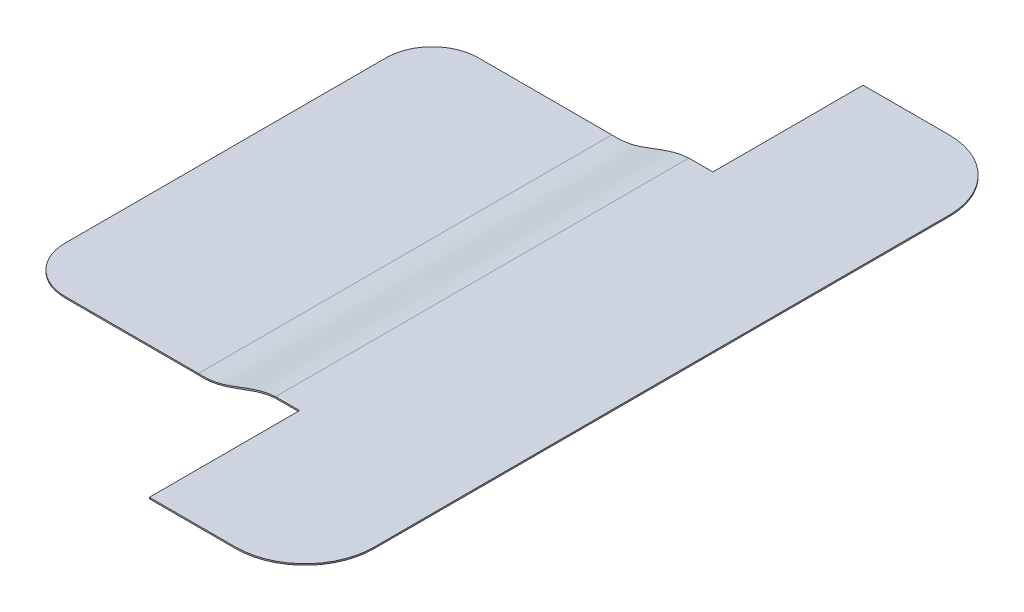
from build123d import *

# Parameters (mm, degrees)
BOSS_EXTRUDE1_DEPTH = 15.5
FILLET1_R           = 1.5
SKETCH3_W           = 6.938477294
SKETCH3_H           = 4.706519562
CUT_EXTRUDE2_DEPTH  = 15.5
FILLET2_R           = 1


with BuildPart() as part:
    # Sketch1 → Boss-Extrude1 (new body)
    with BuildSketch(Plane.XY):
        with BuildLine():
            Line((-1.427597117, 0), (2.472402883, 0))
            add(Edge.make_bspline(
                [(2.472402883, 0), (3.072460434, -0.048698197), (3.560293386, 0.364713913), (4.145454545, 0.4)],
                knots=[0, 0, 0, 0, 1, 1, 1, 1], degree=3))
            Line((4.145454545, 0.4), (8.045454545, 0.4))
            Line((8.045454545, 0.4), (8.045454545, 0.37))
            Line((8.045454545, 0.37), (4.146363347, 0.37))
            add(Edge.make_bspline(
                [(2.471195031, -0.03), (2.760549874, -0.053194299), (3.338778541, 0.131190612), (3.862676211, 0.35269873), (4.146363347, 0.37)],
                knots=[0.000660696, 0.000660696, 0.000660696, 0.000660696, 0.500069024, 0.999477352, 0.999477352, 0.999477352, 0.999477352], degree=3))
            Line((2.471195031, -0.03), (-1.427597117, -0.03))
            Line((-1.427597117, -0.03), (-1.427597117, 0))
        make_face()
    extrude(amount=BOSS_EXTRUDE1_DEPTH)

    # Fillet1
    fillet1_edges = [part.edges().sort_by_distance(p)[0] for p in [
        (8.045454545, 0.385, 15.5),
        (8.045454545, 0.385, 0),
    ]]
    fillet(fillet1_edges, radius=FILLET1_R)

    # Sketch3 → Cut-Extrude2 (cut)
    with BuildSketch(Plane(origin=(0, 0.4, 0), x_dir=(1, 0, 0), z_dir=(0, 1, 0))):
        with Locations((1.198273034, -0.908564347)):
            Rectangle(SKETCH3_W, SKETCH3_H)
        with Locations((1.198273034, -14.591435653)):
            Rectangle(SKETCH3_W, SKETCH3_H)
    extrude(amount=-CUT_EXTRUDE2_DEPTH, mode=Mode.SUBTRACT)

    # Fillet2
    fillet2_edges = [part.edges().sort_by_distance(p)[0] for p in [
        (-1.427597117, -0.015, 3.261824128),
        (-1.427597117, -0.015, 12.238175872),
    ]]
    fillet(fillet2_edges, radius=FILLET2_R)


solid = part.part
